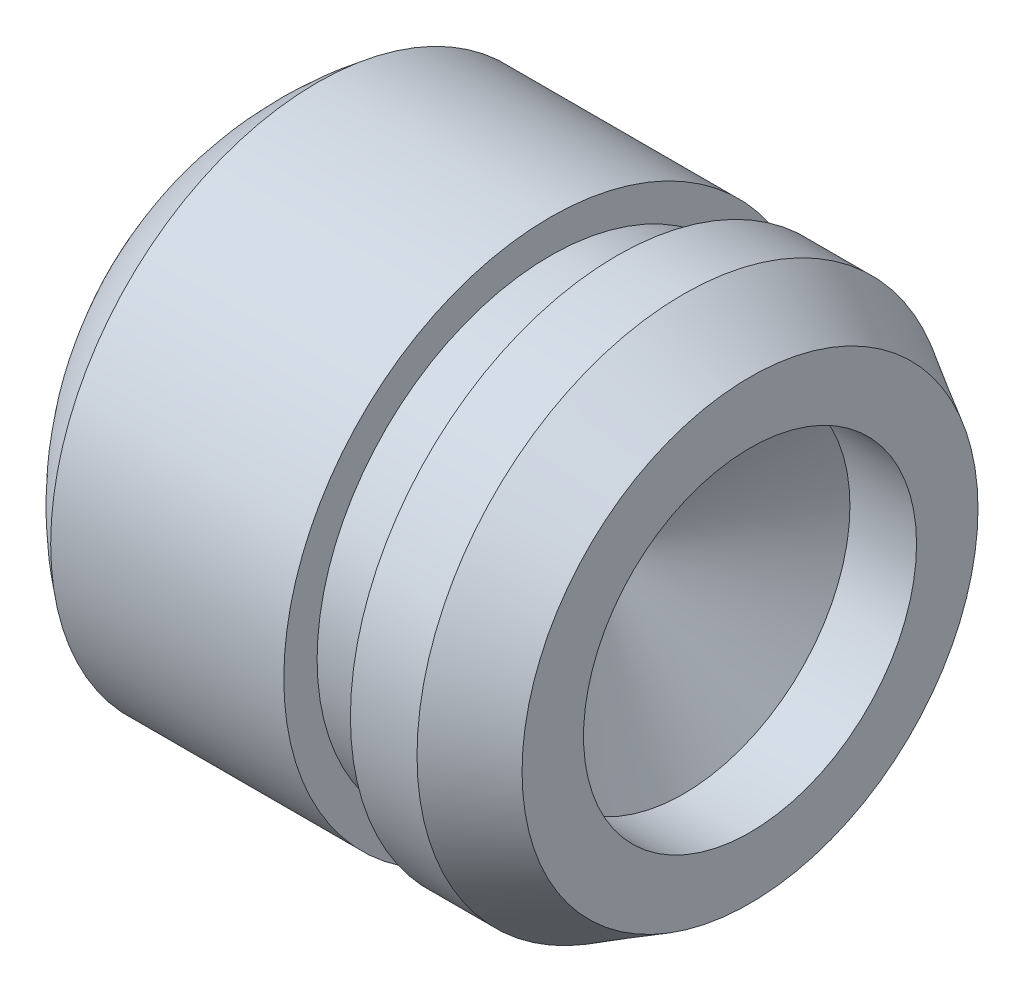
from build123d import *

# Parameters (mm, degrees)
F_10_0_10_DIAMETER_HOLE1_D     = 10
F_10_0_10_DIAMETER_HOLE1_DEPTH = 2
F_10_0_10_DIAMETER_HOLE1_TIP   = 3.004303095


with BuildPart() as part:
    # Sketch1 → Revolve1 (revolve)
    with BuildSketch(Plane.XY, mode=Mode.PRIVATE) as revolve1_sk:
        with BuildLine():
            Line((17, 0), (17, 6.845299462))
            Line((17, 6.845299462), (15, 8))
            Line((15, 8), (13, 8))
            Line((13, 8), (13, 7))
            Line((13, 7), (11, 7))
            Line((11, 7), (11, 8))
            Line((11, 8), (4, 8))
            ThreePointArc((4, 8), (1.05572809, 4.472135955), (0, 0))
            Line((0, 0), (17, 0))
        make_face()
    revolve(revolve1_sk.sketch.rotate(Axis((0, 0, 0), (1, 0, 0)), 90), axis=Axis((0, 0, 0), (1, 0, 0)))

    # Ø10.0 (10) Diameter Hole1
    with Locations(Plane(origin=(17, 0, 0), x_dir=(0, 0, -1), z_dir=(1, 0, 0))):
        with Locations((0, 0)):
            Hole(F_10_0_10_DIAMETER_HOLE1_D / 2, depth=F_10_0_10_DIAMETER_HOLE1_DEPTH)
            with Locations((0, 0, -(F_10_0_10_DIAMETER_HOLE1_DEPTH + F_10_0_10_DIAMETER_HOLE1_TIP / 2))):  # 118° drill point
                Cone(0, F_10_0_10_DIAMETER_HOLE1_D / 2, F_10_0_10_DIAMETER_HOLE1_TIP, mode=Mode.SUBTRACT)


solid = part.part
